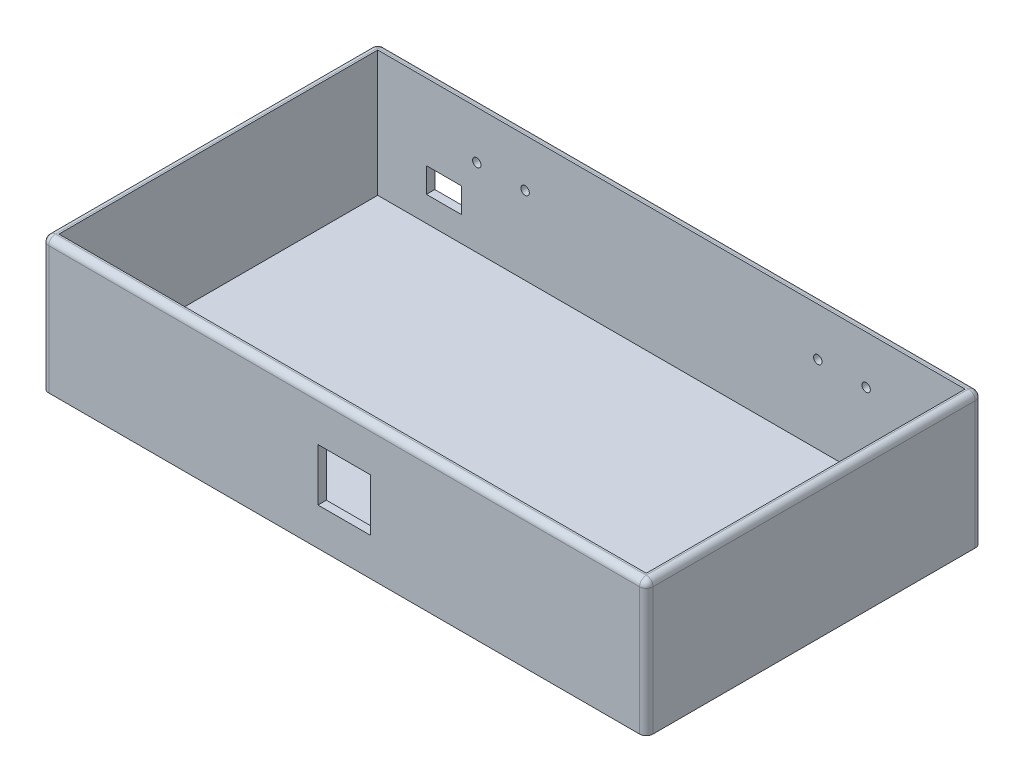
from build123d import *

# Parameters (mm, degrees)
SKETCH1_W           = 457.2
SKETCH1_H           = 254
BOSS_EXTRUDE1_DEPTH = 101.6
SHELL1_T            = -6.35
FILLET1_R           = 5.08
CUT_EXTRUDE1_REACH  = 358.506
SKETCH3_W           = 39.624
SKETCH3_H           = 39.624
CUT_EXTRUDE3_REACH  = 358.506
SKETCH6_R           = 3.175
CUT_EXTRUDE4_REACH  = 358.506
SKETCH7_W           = 26.67
SKETCH7_H           = 18.796


with BuildPart() as part:
    # Sketch1 → Boss-Extrude1 (new body)
    with BuildSketch(Plane(origin=(0, 0, 0), x_dir=(1, 0, 0), z_dir=(0, 1, 0))):
        Rectangle(SKETCH1_W, SKETCH1_H)
    extrude(amount=BOSS_EXTRUDE1_DEPTH)

    # Shell1
    shell1_openings = [part.faces().sort_by_distance(p)[0] for p in [
        (0, 101.6, 0),
    ]]
    offset(amount=SHELL1_T, openings=shell1_openings, kind=Kind.INTERSECTION)

    # Fillet1
    fillet1_edges = [part.edges().sort_by_distance(p)[0] for p in [
        (228.6, 101.6, 0),
        (0, 101.6, -127),
        (-228.6, 101.6, 0),
        (0, 101.6, 127),
        (-228.6, 50.8, -127),
        (228.6, 50.8, -127),
        (228.6, 50.8, 127),
        (-228.6, 50.8, 127),
    ]]
    fillet(fillet1_edges, radius=FILLET1_R)

    # Sketch3 → Cut-Extrude1 (cut, up to next)
    with BuildSketch(Plane.XY.offset(127), mode=Mode.PRIVATE) as cut_extrude1_sk1:
        with Locations((0, 48.26)):
            Rectangle(SKETCH3_W, SKETCH3_H)
    cut_extrude1_tool1 = extrude(cut_extrude1_sk1.sketch, amount=-CUT_EXTRUDE1_REACH, mode=Mode.PRIVATE) & part.part
    add(cut_extrude1_tool1.solids().sort_by_distance((0, 48.26, 127))[0], mode=Mode.SUBTRACT)

    # Sketch6 → Cut-Extrude3 (cut, up to next)
    with BuildSketch(Plane(origin=(0, 0, -127), x_dir=(-1, 0, 0), z_dir=(0, 0, -1)), mode=Mode.PRIVATE) as cut_extrude3_sk1:
        with Locations((147.32, 65.278)):
            Circle(SKETCH6_R)
    cut_extrude3_tool1 = extrude(cut_extrude3_sk1.sketch, amount=-CUT_EXTRUDE3_REACH, mode=Mode.PRIVATE) & part.part
    # Sketch6 → Cut-Extrude3 (cut, up to next)
    with BuildSketch(Plane(origin=(0, 0, -127), x_dir=(-1, 0, 0), z_dir=(0, 0, -1)), mode=Mode.PRIVATE) as cut_extrude3_sk2:
        with Locations((110.744, 65.278)):
            Circle(SKETCH6_R)
    cut_extrude3_tool2 = extrude(cut_extrude3_sk2.sketch, amount=-CUT_EXTRUDE3_REACH, mode=Mode.PRIVATE) & part.part
    # Sketch6 → Cut-Extrude3 (cut, up to next)
    with BuildSketch(Plane(origin=(0, 0, -127), x_dir=(-1, 0, 0), z_dir=(0, 0, -1)), mode=Mode.PRIVATE) as cut_extrude3_sk3:
        with Locations(Location((-147.32, 65.278, 0), (0, 0, 180))):
            Circle(SKETCH6_R)
    cut_extrude3_tool3 = extrude(cut_extrude3_sk3.sketch, amount=-CUT_EXTRUDE3_REACH, mode=Mode.PRIVATE) & part.part
    # Sketch6 → Cut-Extrude3 (cut, up to next)
    with BuildSketch(Plane(origin=(0, 0, -127), x_dir=(-1, 0, 0), z_dir=(0, 0, -1)), mode=Mode.PRIVATE) as cut_extrude3_sk4:
        with Locations(Location((-110.744, 65.278, 0), (0, 0, 180))):
            Circle(SKETCH6_R)
    cut_extrude3_tool4 = extrude(cut_extrude3_sk4.sketch, amount=-CUT_EXTRUDE3_REACH, mode=Mode.PRIVATE) & part.part
    add(cut_extrude3_tool1.solids().sort_by_distance((-147.32, 65.278, -127))[0], mode=Mode.SUBTRACT)
    add(cut_extrude3_tool2.solids().sort_by_distance((-110.744, 65.278, -127))[0], mode=Mode.SUBTRACT)
    add(cut_extrude3_tool3.solids().sort_by_distance((147.32, 65.278, -127))[0], mode=Mode.SUBTRACT)
    add(cut_extrude3_tool4.solids().sort_by_distance((110.744, 65.278, -127))[0], mode=Mode.SUBTRACT)

    # Sketch7 → Cut-Extrude4 (cut, up to next)
    with BuildSketch(Plane(origin=(0, 0, -127), x_dir=(-1, 0, 0), z_dir=(0, 0, -1)), mode=Mode.PRIVATE) as cut_extrude4_sk1:
        with Locations((172.085, 34.798)):
            Rectangle(SKETCH7_W, SKETCH7_H)
    cut_extrude4_tool1 = extrude(cut_extrude4_sk1.sketch, amount=-CUT_EXTRUDE4_REACH, mode=Mode.PRIVATE) & part.part
    add(cut_extrude4_tool1.solids().sort_by_distance((-172.085, 34.798, -127))[0], mode=Mode.SUBTRACT)


solid = part.part
